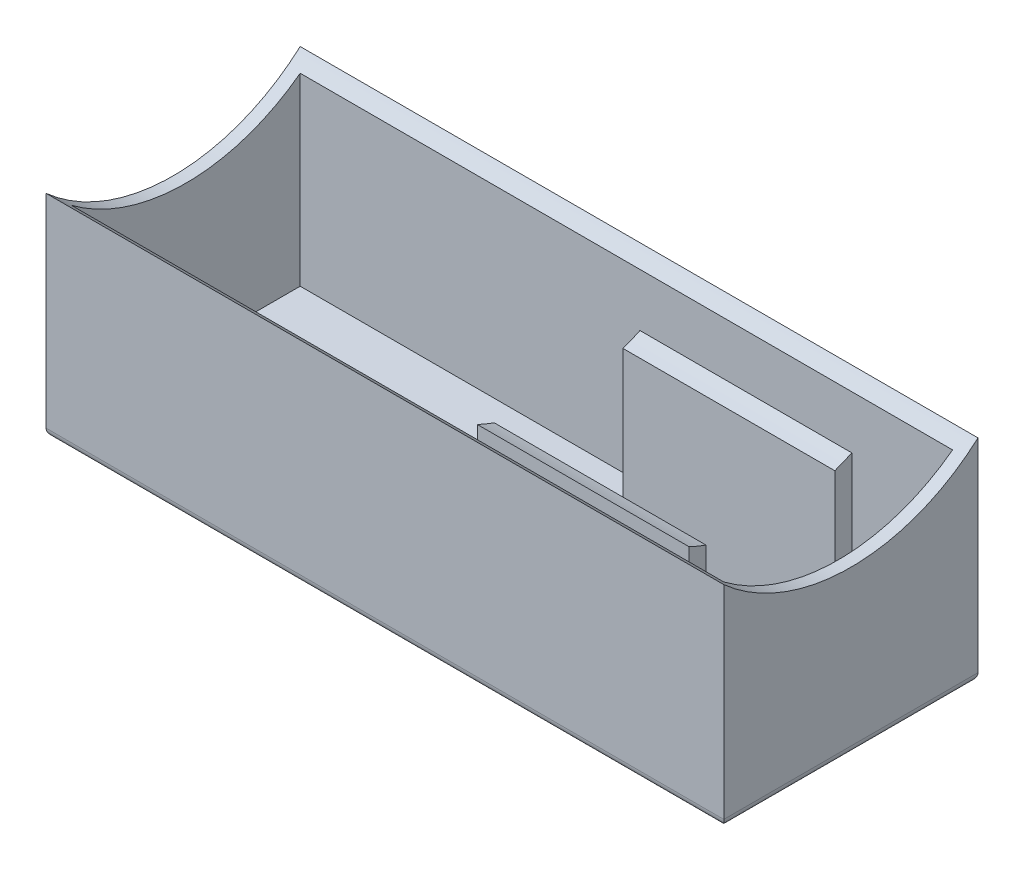
from build123d import *

# Parameters (mm, degrees)
SKETCH1_W           = 80
SKETCH1_H           = 30
SKETCH1_W_2         = 77
SKETCH1_H_2         = 27
BOSS_EXTRUDE1_DEPTH = 2
SKETCH1_3_W         = 80
SKETCH1_3_H         = 30
SKETCH1_3_W_2       = 77
SKETCH1_3_H_2       = 27
BOSS_EXTRUDE2_DEPTH = 25
SKETCH2_W           = 25
SKETCH2_H           = 2
BOSS_EXTRUDE3_DEPTH = 23
CUT_EXTRUDE1_DEPTH  = 86.14693183
FILLET1_R           = 1


with BuildPart() as part:
    # Sketch1 → Boss-Extrude1 (new body)
    # profile 1 of 2: a face of its own
    with BuildSketch(Plane(origin=(0, 0, 0), x_dir=(1, 0, 0), z_dir=(0, 1, 0))):
        Rectangle(SKETCH1_W, SKETCH1_H)
        Rectangle(SKETCH1_W_2, SKETCH1_H_2, mode=Mode.SUBTRACT)
    # profile 2 of 2: a face of its own
    with BuildSketch(Plane(origin=(0, 0, 0), x_dir=(1, 0, 0), z_dir=(0, 1, 0))):
        Rectangle(SKETCH1_W_2, SKETCH1_H_2)
    extrude(amount=BOSS_EXTRUDE1_DEPTH)

    # Sketch1<3> → Boss-Extrude2 (add)
    with BuildSketch(Plane(origin=(0, 0, 0), x_dir=(1, 0, 0), z_dir=(0, 1, 0))):
        Rectangle(SKETCH1_3_W, SKETCH1_3_H)
        Rectangle(SKETCH1_3_W_2, SKETCH1_3_H_2, mode=Mode.SUBTRACT)
    extrude(amount=BOSS_EXTRUDE2_DEPTH)

    # Sketch2 → Boss-Extrude3 (add)
    with BuildSketch(Plane(origin=(0, 2, 0), x_dir=(1, 0, 0), z_dir=(0, 1, 0))):
        with Locations((18, 8.6)):
            Rectangle(SKETCH2_W, SKETCH2_H)
        with Locations((18, -8.6)):
            Rectangle(SKETCH2_W, SKETCH2_H)
    extrude(amount=BOSS_EXTRUDE3_DEPTH)

    # Sketch3 → Cut-Extrude1 (cut, through all)
    with BuildSketch(Plane(origin=(40, 0, 0), x_dir=(0, 0, -1), z_dir=(1, 0, 0))):
        with BuildLine():
            Line((-15, 25), (15, 25))
            ThreePointArc((15, 25), (0, 19.270509831), (-15, 25))
        make_face()
    extrude(amount=-CUT_EXTRUDE1_DEPTH, mode=Mode.SUBTRACT)

    # Fillet1
    fillet1_edges = [part.edges().sort_by_distance(p)[0] for p in [
        (-40, 0, 0),
        (0, 0, -15),
        (40, 0, 0),
        (0, 0, 15),
    ]]
    fillet(fillet1_edges, radius=FILLET1_R)


solid = part.part
